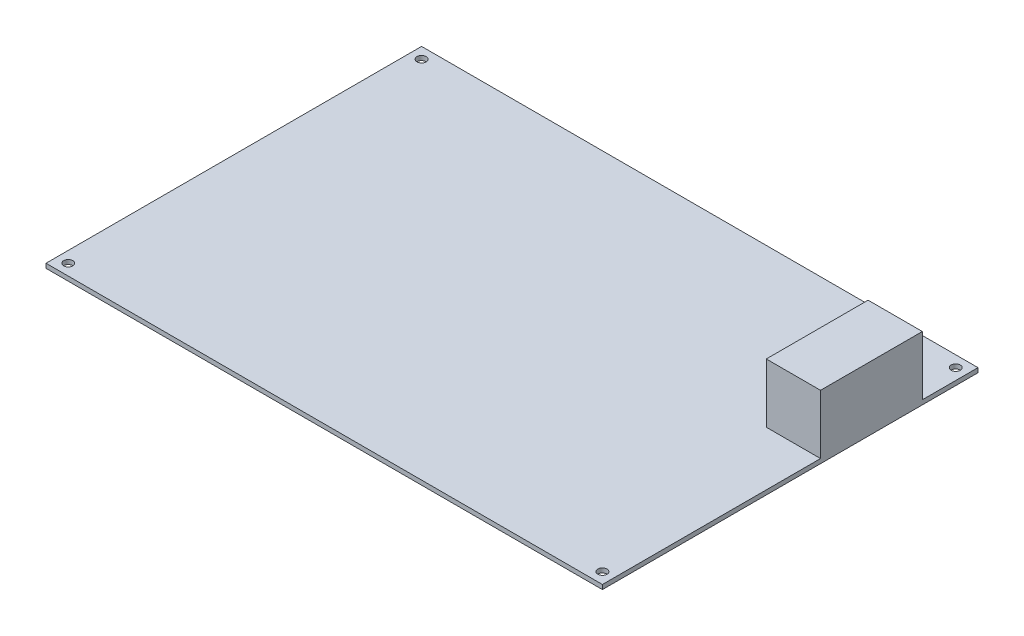
from build123d import *

# Parameters (mm, degrees)
SKETCH1_W           = 200
SKETCH1_H           = 135
SKETCH1_R           = 1.65
BOSS_EXTRUDE1_DEPTH = 1.6
SKETCH2_W           = 36.6
SKETCH2_H           = 21.25
BOSS_EXTRUDE2_DEPTH = 19.5


with BuildPart() as part:
    # Sketch1 → Boss-Extrude1 (new body)
    with BuildSketch(Plane(origin=(0, 0, 0), x_dir=(1, 0, 0), z_dir=(0, 1, 0))):
        with Locations((100, 67.5)):
            Rectangle(SKETCH1_W, SKETCH1_H)
        with Locations(Location((196, 131, 0), (0, 0, 270))):
            Circle(SKETCH1_R, mode=Mode.SUBTRACT)
        with Locations(Location((4, 131, 0), (0, 0, 90))):
            Circle(SKETCH1_R, mode=Mode.SUBTRACT)
        with Locations(Location((4, 4, 0), (0, 0, 270))):
            Circle(SKETCH1_R, mode=Mode.SUBTRACT)
        with Locations(Location((196, 4, 0), (0, 0, 90))):
            Circle(SKETCH1_R, mode=Mode.SUBTRACT)
    extrude(amount=BOSS_EXTRUDE1_DEPTH)

    # Sketch2 → Boss-Extrude2 (add)
    with BuildSketch(Plane(origin=(200, 0, 0), x_dir=(0, 0, -1), z_dir=(1, 0, 0))):
        with Locations((96.7, 12.225)):
            Rectangle(SKETCH2_W, SKETCH2_H)
    extrude(amount=-BOSS_EXTRUDE2_DEPTH)


solid = part.part
